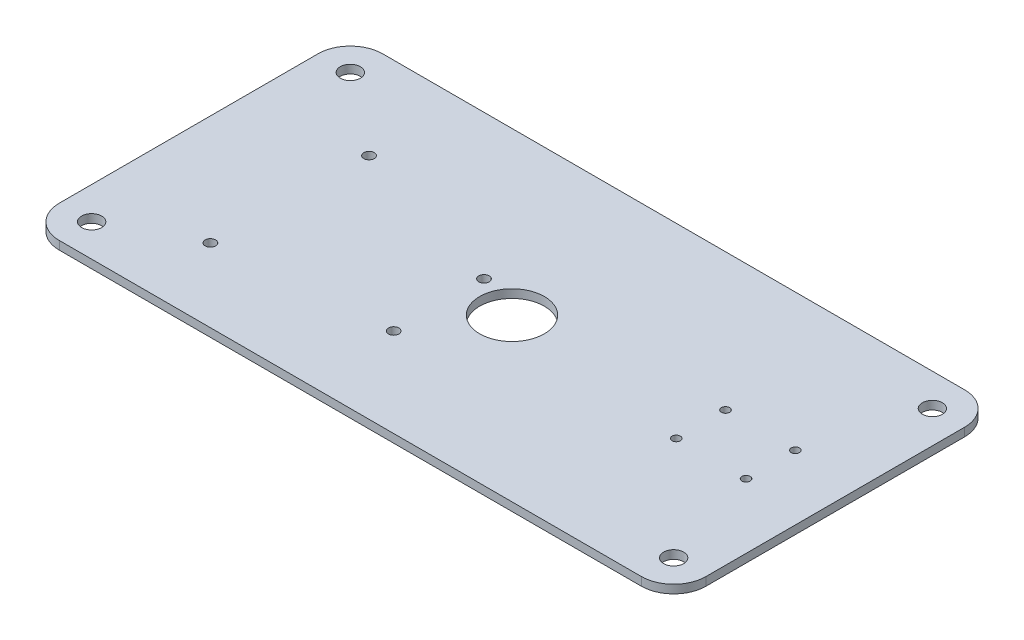
from build123d import *

# Parameters (mm, degrees)
SKETCH1_W               = 200
SKETCH1_H               = 100
BOSS_EXTRUDE1_DEPTH     = 2.6
FILLET1_R               = 10
SKETCH6_R               = 3.1
CUT_EXTRUDE6_DEPTH      = 2.6
MIRROR6_COPY_1_SKETCH_R = 3.1
MIRROR6_COPY_1_DEPTH    = 2.6
MIRROR6_COPY_2_SKETCH_R = 3.1
MIRROR6_COPY_2_DEPTH    = 2.6
SKETCH16_R              = 1.61925
CUT_EXTRUDE9_DEPTH      = 10
SKETCH17_R              = 1.61925
CUT_EXTRUDE10_DEPTH     = 224.621913059
SKETCH18_R              = 1.61925
CUT_EXTRUDE11_DEPTH     = 224.621913059
SKETCH19_R              = 1.61925
CUT_EXTRUDE12_DEPTH     = 224.621913059
SKETCH15_R              = 10
CUT_EXTRUDE14_DEPTH     = 224.621913059
SKETCH20_R              = 1.27
CUT_EXTRUDE15_DEPTH     = 224.621913059


with BuildPart() as part:
    # Sketch1 → Boss-Extrude1 (new body)
    with BuildSketch(Plane(origin=(0, 0, 0), x_dir=(1, 0, 0), z_dir=(0, 1, 0))):
        with Locations((100, -50)):
            Rectangle(SKETCH1_W, SKETCH1_H)
    extrude(amount=BOSS_EXTRUDE1_DEPTH)

    # Fillet1
    fillet1_edges = [part.edges().sort_by_distance(p)[0] for p in [
        (0, 1.3, 0),
        (0, 1.3, 100),
        (200, 1.3, 100),
        (200, 1.3, 0),
    ]]
    fillet(fillet1_edges, radius=FILLET1_R)

    # Sketch6 → Cut-Extrude6 (cut)
    with BuildSketch(Plane.XZ):
        with Locations((190, 10)):
            Circle(SKETCH6_R)
    cut_extrude6 = extrude(amount=-CUT_EXTRUDE6_DEPTH, mode=Mode.SUBTRACT)

    # Mirror5: Cut-Extrude6 across plane
    add(cut_extrude6.mirror(Plane(origin=(100, 0, 0), x_dir=(0, 0, 1), z_dir=(1, 0, 0))), mode=Mode.SUBTRACT)

    # Mirror6 copy 1 sketch → Mirror6 copy 1 (cut)
    with BuildSketch(Plane(origin=(200, 0, 100), x_dir=(-1, 0, 0), z_dir=(0, -1, 0))):
        with Locations((190, 10)):
            Circle(MIRROR6_COPY_1_SKETCH_R)
    extrude(amount=-MIRROR6_COPY_1_DEPTH, mode=Mode.SUBTRACT)

    # Mirror6 copy 2 sketch → Mirror6 copy 2 (cut)
    with BuildSketch(Plane(origin=(0, 0, 100), x_dir=(1, 0, 0), z_dir=(0, -1, 0))):
        with Locations((190, -10)):
            Circle(MIRROR6_COPY_2_SKETCH_R)
    extrude(amount=-MIRROR6_COPY_2_DEPTH, mode=Mode.SUBTRACT)

    # Sketch16 → Cut-Extrude9 (cut)
    with BuildSketch(Plane(origin=(0, 2.6, 0), x_dir=(1, 0, 0), z_dir=(0, 1, 0))):
        with Locations((35.15745, -29.37145)):
            Circle(SKETCH16_R)
    extrude(amount=-CUT_EXTRUDE9_DEPTH, mode=Mode.SUBTRACT)

    # Sketch17 → Cut-Extrude10 (cut, through all)
    with BuildSketch(Plane(origin=(0, 2.6, 0), x_dir=(1, 0, 0), z_dir=(0, 1, 0))):
        with Locations((85.94475, -44.61145)):
            Circle(SKETCH17_R)
    extrude(amount=-CUT_EXTRUDE10_DEPTH, mode=Mode.SUBTRACT)

    # Sketch18 → Cut-Extrude11 (cut, through all)
    with BuildSketch(Plane(origin=(0, 2.6, 0), x_dir=(1, 0, 0), z_dir=(0, 1, 0))):
        with Locations((34.01445, -77.28855)):
            Circle(SKETCH18_R)
    extrude(amount=-CUT_EXTRUDE11_DEPTH, mode=Mode.SUBTRACT)

    # Sketch19 → Cut-Extrude12 (cut, through all)
    with BuildSketch(Plane(origin=(0, 2.6, 0), x_dir=(1, 0, 0), z_dir=(0, 1, 0))):
        with Locations((85.94475, -72.53875)):
            Circle(SKETCH19_R)
    extrude(amount=-CUT_EXTRUDE12_DEPTH, mode=Mode.SUBTRACT)

    # Sketch15 → Cut-Extrude14 (cut, through all)
    with BuildSketch(Plane.XZ):
        with Locations((100, 50)):
            Circle(SKETCH15_R)
    extrude(amount=-CUT_EXTRUDE14_DEPTH, mode=Mode.SUBTRACT)

    # Sketch20 → Cut-Extrude15 (cut, through all)
    with BuildSketch(Plane(origin=(0, 2.6, 0), x_dir=(1, 0, 0), z_dir=(0, 1, 0))):
        with Locations((158.41, -42.38)):
            Circle(SKETCH20_R)
        with Locations((180, -42.38)):
            Circle(SKETCH20_R)
        with Locations((158.41, -57.62)):
            Circle(SKETCH20_R)
        with Locations((180, -57.62)):
            Circle(SKETCH20_R)
    extrude(amount=-CUT_EXTRUDE15_DEPTH, mode=Mode.SUBTRACT)


solid = part.part
